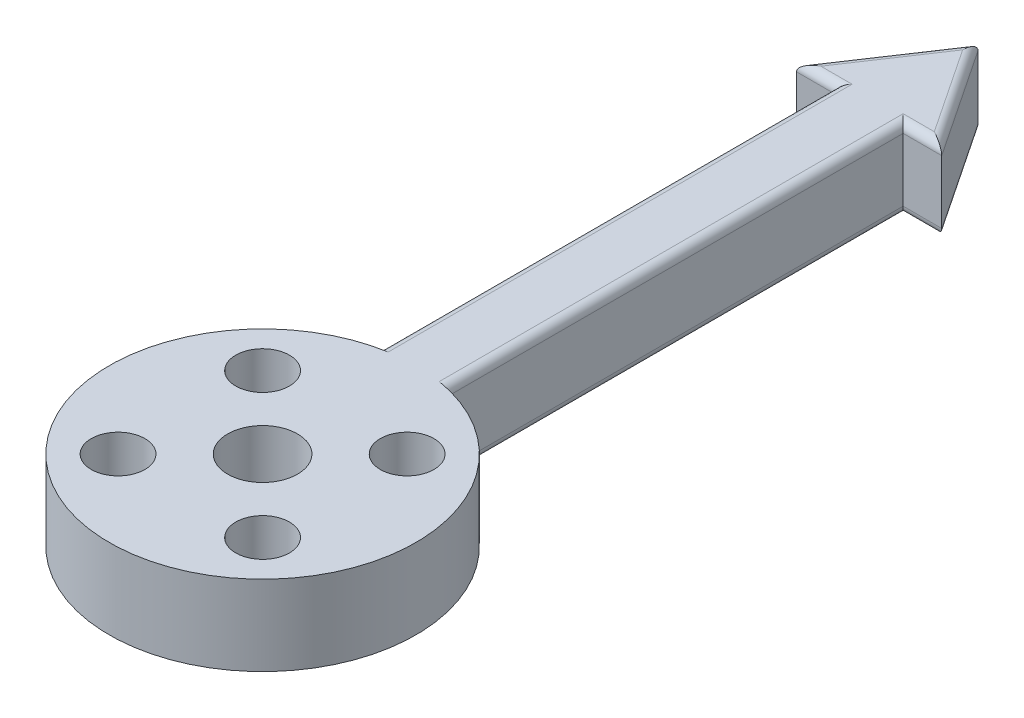
from build123d import *

# Parameters (mm, degrees)
SKETCH2_R           = 9
SKETCH2_R_2         = 2.05
SKETCH2_R_3         = 1.575
BOSS_EXTRUDE2_DEPTH = 4.7
BOSS_EXTRUDE3_START = -4.7
BOSS_EXTRUDE3_DEPTH = 4.7
FILLET1_R           = 0.5


with BuildPart() as part:
    # Sketch2 → Boss-Extrude2 (new body)
    with BuildSketch(Plane(origin=(0, 0, 0), x_dir=(1, 0, 0), z_dir=(0, 1, 0))):
        with Locations(Location((0, 0, 0), (0, 0, 270))):
            Circle(SKETCH2_R)
        with Locations(Location((0, 0, 0), (0, 0, 270))):
            Circle(SKETCH2_R_2, mode=Mode.SUBTRACT)
        with Locations(Location((-4.242640687, 4.242640687, 0), (0, 0, 270))):
            Circle(SKETCH2_R_3, mode=Mode.SUBTRACT)
        with Locations(Location((-4.242640687, -4.242640687, 0), (0, 0, 270))):
            Circle(SKETCH2_R_3, mode=Mode.SUBTRACT)
        with Locations(Location((4.242640687, -4.242640687, 0), (0, 0, 270))):
            Circle(SKETCH2_R_3, mode=Mode.SUBTRACT)
        with Locations(Location((4.242640687, 4.242640687, 0), (0, 0, 270))):
            Circle(SKETCH2_R_3, mode=Mode.SUBTRACT)
    extrude(amount=BOSS_EXTRUDE2_DEPTH)

    # Sketch3 → Boss-Extrude3 (add)
    with BuildSketch(Plane(origin=(0, 4.7, 0), x_dir=(1, 0, 0), z_dir=(0, 1, 0)).offset(BOSS_EXTRUDE3_START)):
        with BuildLine():
            Line((-2, 35.606375805), (-2, 8.774964387))
            ThreePointArc((-2, 8.774964387), (0, 9), (2, 8.774964387))
            Line((2, 8.774964387), (2, 35.606375805))
            Line((2, 35.606375805), (4.264997114, 35.606375805))
            Line((4.264997114, 35.606375805), (0, 42))
            Line((0, 42), (-4.264997114, 35.606375805))
            Line((-4.264997114, 35.606375805), (-2, 35.606375805))
        make_face()
    extrude(amount=BOSS_EXTRUDE3_DEPTH)

    # Fillet1
    fillet1_edges = [part.edges().sort_by_distance(p)[0] for p in [
        (-3.132498557, 4.7, -35.606375805),
        (-2, 4.7, -22.190670096),
        (2, 4.7, -22.190670096),
        (3.132498557, 4.7, -35.606375805),
        (2.132498557, 4.7, -38.803187903),
        (-2.132498557, 4.7, -38.803187903),
        (-3.132498557, 0, -35.606375805),
        (-2.132498557, 0, -38.803187903),
        (2.132498557, 0, -38.803187903),
        (3.132498557, 0, -35.606375805),
        (2, 0, -22.190670096),
        (-2, 0, -22.190670096),
    ]]
    fillet(fillet1_edges, radius=FILLET1_R)


solid = part.part
